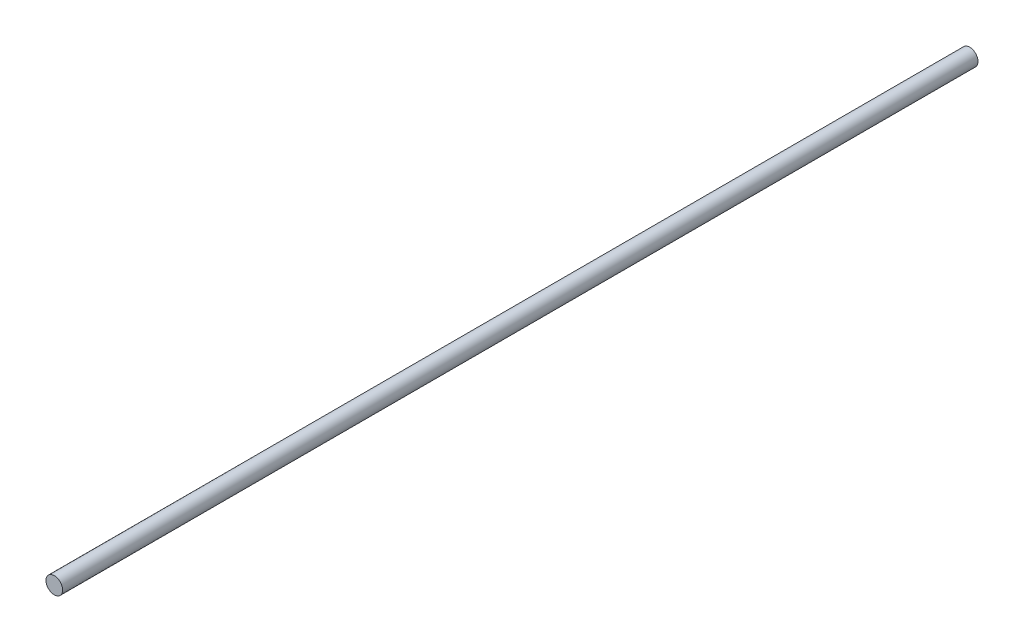
from build123d import *

# Parameters (mm, degrees)
SZKIC1_R                    = 4
DODANIE_WYCI_GNI_CIE1_DEPTH = 440


with BuildPart() as part:
    # Szkic1 → Dodanie-wyciągnięcie1 (new body)
    with BuildSketch(Plane.XY):
        Circle(SZKIC1_R)
    extrude(amount=DODANIE_WYCI_GNI_CIE1_DEPTH)


solid = part.part
